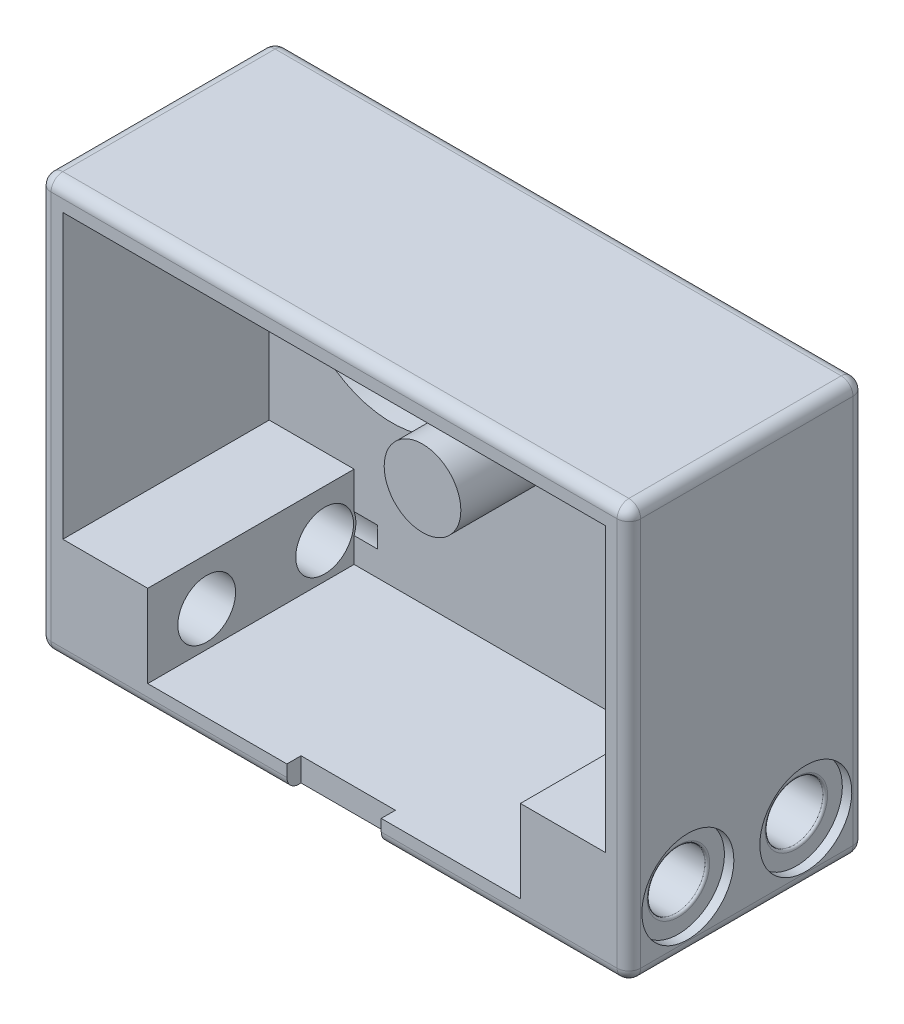
from build123d import *

# Parameters (mm, degrees)
SKETCH1_W            = 50
SKETCH1_H            = 35
SKETCH1_R            = 8.4
BOSS_EXTRUDE1_DEPTH  = 2.5
SKETCH2_W            = 50
SKETCH2_H            = 35
SKETCH2_W_2          = 46
SKETCH2_H_2          = 31
BOSS_EXTRUDE2_DEPTH  = 17.5
SKETCH3_R            = 3.25
BOSS_EXTRUDE3_DEPTH  = 10
SKETCH5_W            = 20
SKETCH5_H            = 9
BOSS_EXTRUDE4_DEPTH  = 9.2
SKETCH4_R            = 2.45
CUT_EXTRUDE1_DEPTH   = 9.2
SKETCH6_R            = 2.65
CUT_EXTRUDE2_DEPTH   = 2
SKETCH7_R            = 3.9
CUT_EXTRUDE3_DEPTH   = 0.8
FILLET1_R            = 0.2
FILLET1_OF_MIRROR1_R = 0.2
FILLET2_R            = 1
SKETCH8_W            = 8
SKETCH8_H            = 2.4
CUT_EXTRUDE4_DEPTH   = 6.8


with BuildPart() as part:
    # Sketch1 → Boss-Extrude1 (new body)
    with BuildSketch(Plane.XY):
        Rectangle(SKETCH1_W, SKETCH1_H)
        with Locations((-12.6, 4.9)):
            Circle(SKETCH1_R, mode=Mode.SUBTRACT)
        with Locations((12.6, 4.9)):
            Circle(SKETCH1_R, mode=Mode.SUBTRACT)
    extrude(amount=BOSS_EXTRUDE1_DEPTH)

    # Sketch2 → Boss-Extrude2 (add)
    with BuildSketch(Plane.XY.offset(2.5)):
        Rectangle(SKETCH2_W, SKETCH2_H)
        Rectangle(SKETCH2_W_2, SKETCH2_H_2, mode=Mode.SUBTRACT)
    extrude(amount=BOSS_EXTRUDE2_DEPTH)

    # Sketch3 → Boss-Extrude3 (add)
    with BuildSketch(Plane.XY.offset(2.5)):
        with Locations(Location((0, 2.994491696, 0), (0, 0, 180))):
            Circle(SKETCH3_R)
    extrude(amount=BOSS_EXTRUDE3_DEPTH)

    # Sketch5 → Boss-Extrude4 (add)
    with BuildSketch(Plane(origin=(25, 0, 0), x_dir=(0, 0, -1), z_dir=(1, 0, 0))):
        with Locations((-10, -13)):
            Rectangle(SKETCH5_W, SKETCH5_H)
    boss_extrude4 = extrude(amount=-BOSS_EXTRUDE4_DEPTH)

    # Sketch4 → Cut-Extrude1 (cut)
    with BuildSketch(Plane(origin=(25, 0, 0), x_dir=(0, 0, -1), z_dir=(1, 0, 0))):
        with Locations((-5, -12.5)):
            Circle(SKETCH4_R)
        with Locations((-15, -12.5)):
            Circle(SKETCH4_R)
    cut_extrude1 = extrude(amount=-CUT_EXTRUDE1_DEPTH, mode=Mode.SUBTRACT)

    # Sketch6 → Cut-Extrude2 (cut)
    with BuildSketch(Plane.ZY.offset(-15.8)):
        with Locations((5, -12.5)):
            Circle(SKETCH6_R)
    cut_extrude2 = extrude(amount=CUT_EXTRUDE2_DEPTH, mode=Mode.SUBTRACT)

    # Sketch7 → Cut-Extrude3 (cut)
    with BuildSketch(Plane(origin=(25, 0, 0), x_dir=(0, 0, -1), z_dir=(1, 0, 0))):
        with Locations(Location((-15, -12.5, 0), (0, 0, 90))):
            Circle(SKETCH7_R)
        with Locations(Location((-5, -12.5, 0), (0, 0, 90))):
            Circle(SKETCH7_R)
    cut_extrude3 = extrude(amount=-CUT_EXTRUDE3_DEPTH, mode=Mode.SUBTRACT)

    # Fillet1
    fillet1_edges = [part.edges().sort_by_distance(p)[0] for p in [
        (24.2, -12.5, 17.45),
        (24.2, -12.5, 7.45),
    ]]
    fillet(fillet1_edges, radius=FILLET1_R)

    # Mirror1: Boss-Extrude4, Cut-Extrude1, Cut-Extrude2, Cut-Extrude3 across plane
    add(boss_extrude4.mirror(Plane(origin=(0, 0, 0), x_dir=(0, 0, 1), z_dir=(1, 0, 0))))
    add(cut_extrude1.mirror(Plane(origin=(0, 0, 0), x_dir=(0, 0, 1), z_dir=(1, 0, 0))), mode=Mode.SUBTRACT)
    add(cut_extrude2.mirror(Plane(origin=(0, 0, 0), x_dir=(0, 0, 1), z_dir=(1, 0, 0))), mode=Mode.SUBTRACT)
    add(cut_extrude3.mirror(Plane(origin=(0, 0, 0), x_dir=(0, 0, 1), z_dir=(1, 0, 0))), mode=Mode.SUBTRACT)

    # Fillet1 of Mirror1
    fillet1_of_mirror1_edges = [part.edges().sort_by_distance(p)[0] for p in [
        (-24.2, -12.5, 17.45),
        (-24.2, -12.5, 7.45),
    ]]
    fillet(fillet1_of_mirror1_edges, radius=FILLET1_OF_MIRROR1_R)

    # Fillet2
    fillet2_edges = [part.edges().sort_by_distance(p)[0] for p in [
        (-21, 4.9, 0),
        (4.2, 4.9, 0),
        (0, -17.5, 20),
        (25, 0, 20),
        (0, 17.5, 20),
        (-25, 0, 20),
        (0, -17.5, 0),
        (-25, 0, 0),
        (0, 17.5, 0),
        (25, 0, 0),
        (25, -17.5, 10),
        (-25, -17.5, 10),
        (-25, 17.5, 10),
        (25, 17.5, 10),
    ]]
    fillet(fillet2_edges, radius=FILLET2_R)

    # Sketch8 → Cut-Extrude4 (cut)
    with BuildSketch(Plane.XZ.offset(17.5)):
        with Locations((0, 20)):
            Rectangle(SKETCH8_W, SKETCH8_H)
    extrude(amount=-CUT_EXTRUDE4_DEPTH, mode=Mode.SUBTRACT)


solid = part.part
